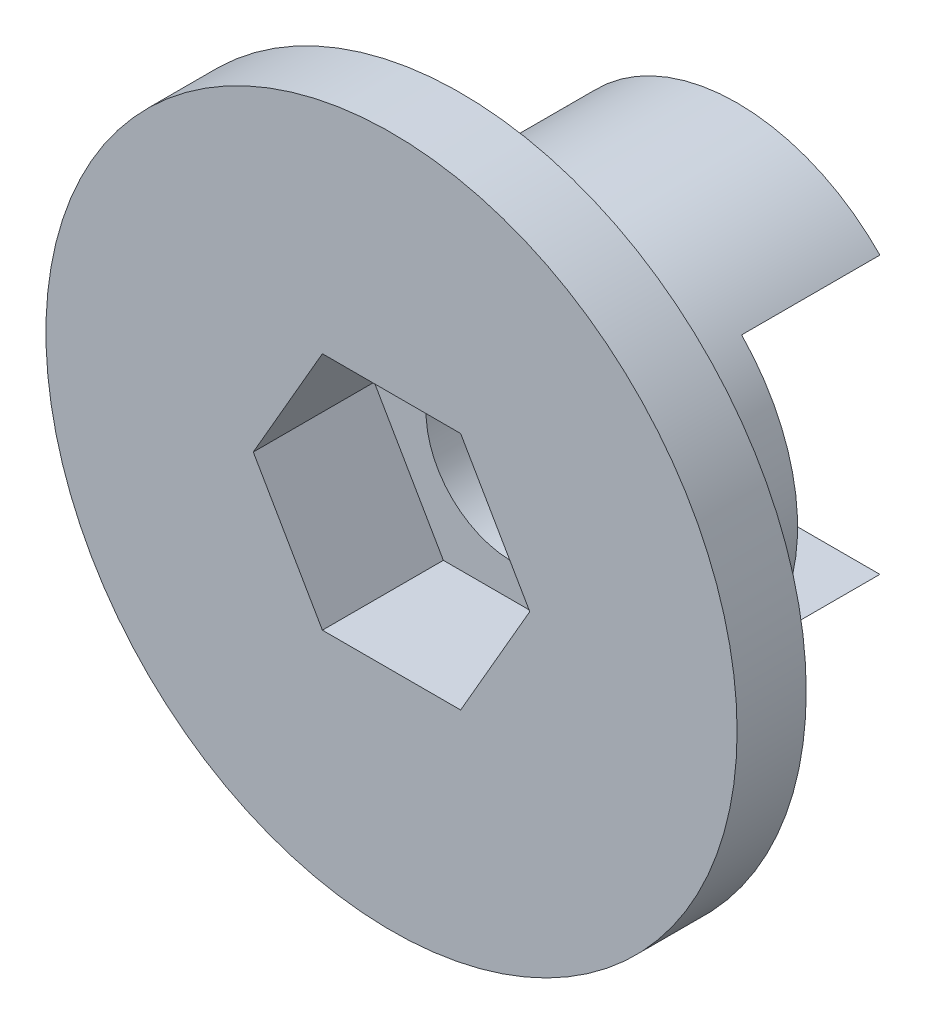
from build123d import *

# Parameters (mm, degrees)
SKETCH1_R               = 11.5
SKETCH1_R_2             = 5
BOSS_EXTRUDE1_DEPTH     = 20
CUT_EXTRUDE1_DEPTH      = 7
CUT_EXTRUDE2_DEPTH      = 26.777897509
CUT_EXTRUDE2_DEPTH_BACK = 26.777897509
SKETCH3_W               = 8
SKETCH3_H               = 16
BOSS_EXTRUDE2_START     = -4
SKETCH4_R               = 20
SKETCH4_R_2             = 11.5
BOSS_EXTRUDE2_DEPTH     = 4


with BuildPart() as part:
    # Sketch1 → Boss-Extrude1 (new body)
    with BuildSketch(Plane.XY):
        Circle(SKETCH1_R)
        Circle(SKETCH1_R_2, mode=Mode.SUBTRACT)
    extrude(amount=BOSS_EXTRUDE1_DEPTH)

    # Sketch2 → Cut-Extrude1 (cut)
    with BuildSketch(Plane.XY.offset(20)):
        Polygon((8, 0), (4, 6.92820323), (-4, 6.92820323), (-8, 0), (-4, -6.92820323), (4, -6.92820323), align=None)
    extrude(amount=-CUT_EXTRUDE1_DEPTH, mode=Mode.SUBTRACT)

    # Sketch3 → Cut-Extrude2 (cut, two sides: drawn at the far end of the back side and taken through both)
    with BuildSketch(Plane(origin=(0, 0, 0), x_dir=(0, 0, -1), z_dir=(1, 0, 0)).offset(-CUT_EXTRUDE2_DEPTH_BACK)):
        with Locations((-4, 0)):
            Rectangle(SKETCH3_W, SKETCH3_H)
    extrude(amount=CUT_EXTRUDE2_DEPTH + CUT_EXTRUDE2_DEPTH_BACK, mode=Mode.SUBTRACT)

    # Sketch4 → Boss-Extrude2 (add)
    with BuildSketch(Plane.XY.offset(20).offset(BOSS_EXTRUDE2_START)):
        Circle(SKETCH4_R)
        with Locations(Location((0, 0, 0), (0, 0, 135.920790152))):
            Circle(SKETCH4_R_2, mode=Mode.SUBTRACT)
    extrude(amount=BOSS_EXTRUDE2_DEPTH)


solid = part.part
